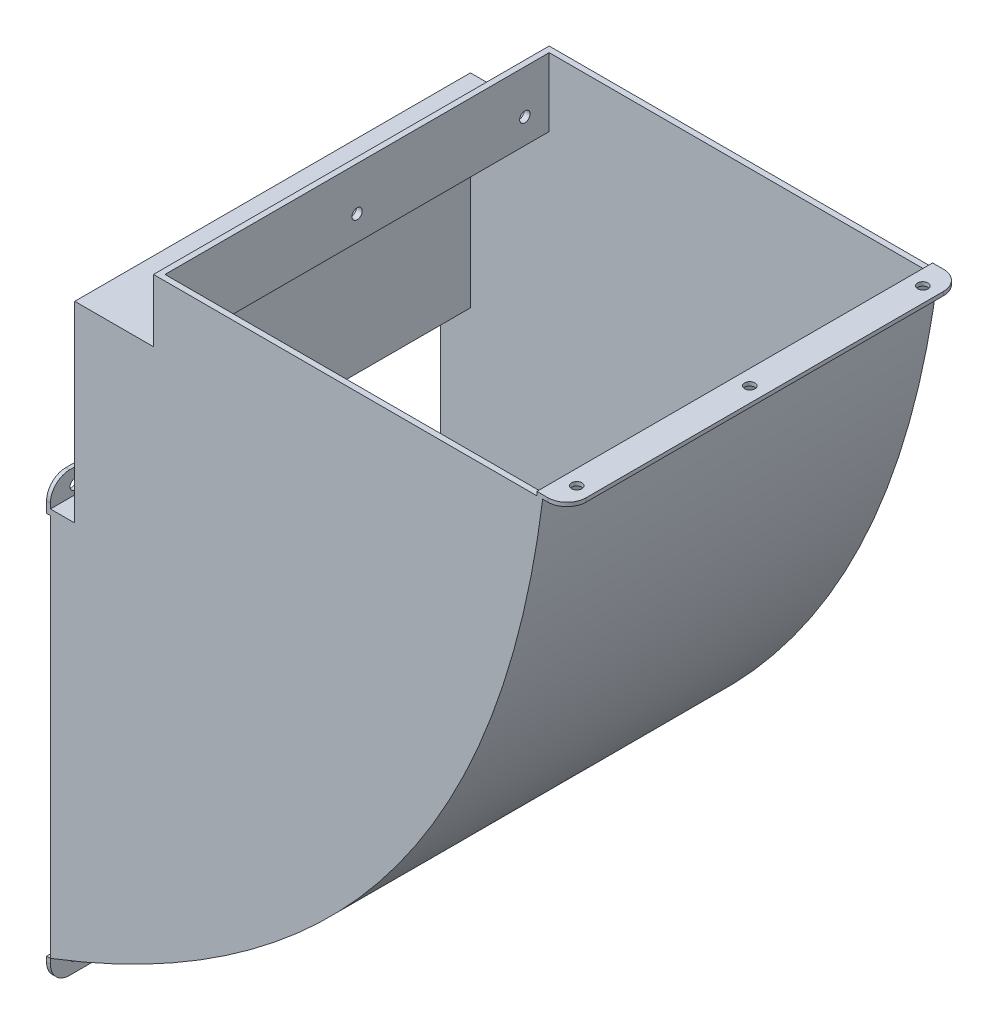
from build123d import *

# Parameters (mm, degrees)
BOSS_EXTRUDE3_DEPTH = 206.587093
SHELL1_T            = -3
BOSS_EXTRUDE4_DEPTH = 2
BOSS_EXTRUDE5_DEPTH = 2
SKETCH8_R           = 2.7
CUT_EXTRUDE2_DEPTH  = 3
SKETCH9_R           = 2.7
CUT_EXTRUDE3_DEPTH  = 2
SKETCH11_R          = 2.7
CUT_EXTRUDE4_DEPTH  = 2


with BuildPart() as part:
    # Sketch1 → Boss-Extrude3 (new body)
    with BuildSketch(Plane.XY):
        with BuildLine():
            Line((244.319092767, 234.634840909), (41.119092767, 234.634840909))
            Line((41.119092767, 234.634840909), (41.119092767, 201.934840909))
            Line((41.119092767, 201.934840909), (0, 201.934840909))
            Line((0, 201.934840909), (0, 101.672858907))
            Line((0, 101.672858907), (-12.7, 101.672858907))
            Line((-12.7, 101.672858907), (-12.7, -101.527141093))
            add(Edge.make_bspline(
                [(-12.7, -101.527141093), (212.797902698, -15.185130796), (244.319092767, 234.634840909)],
                knots=[0, 0, 0, 1, 1, 1], degree=2))
        make_face()
    extrude(amount=BOSS_EXTRUDE3_DEPTH)

    # Shell1
    shell1_openings = [part.faces().sort_by_distance(p)[0] for p in [
        (142.719092767, 234.634840909, 103.2935465),
        (-12.7, 0.072858907, 103.2935465),
    ]]
    offset(amount=SHELL1_T, openings=shell1_openings, kind=Kind.INTERSECTION)

    # Sketch4 → Boss-Extrude4 (add)
    with BuildSketch(Plane(origin=(0, 234.634840909, 0), x_dir=(1, 0, 0), z_dir=(0, 1, 0))):
        with BuildLine():
            Line((257.019092767, -10), (257.019092767, -196.587092864))
            ThreePointArc((257.019092767, -196.587092864), (254.090160579, -203.658160676), (247.019092767, -206.587092864))
            Line((247.019092767, -206.587092864), (244.319092767, -206.587092864))
            Line((244.319092767, -206.587092864), (241.295184716, -206.587092864))
            Line((241.295184716, -206.587092864), (241.295184716, 0))
            Line((241.295184716, 0), (247.019092767, 0))
            ThreePointArc((247.019092767, 0), (254.090160579, -2.928932188), (257.019092767, -10))
        make_face()
    extrude(amount=BOSS_EXTRUDE4_DEPTH)

    # Sketch5 → Boss-Extrude5 (add)
    with BuildSketch(Plane.ZY.offset(12.7)):
        with BuildLine():
            Line((10, 114.372858907), (196.587092864, 114.372858907))
            ThreePointArc((196.587092864, 114.372858907), (203.658160676, 111.443926719), (206.587092864, 104.372858907))
            Line((206.587092864, 104.372858907), (206.587092864, 98.672858907))
            Line((206.587092864, 98.672858907), (0, 98.672858907))
            Line((0, 98.672858907), (0, 104.372858907))
            ThreePointArc((0, 104.372858907), (2.928932188, 111.443926719), (10, 114.372858907))
        make_face()
        with BuildLine():
            Line((0, -101.527141093), (0, -104.227141093))
            ThreePointArc((0, -104.227141093), (2.928932188, -111.298208905), (10, -114.227141093))
            Line((10, -114.227141093), (196.587092864, -114.227141093))
            ThreePointArc((196.587092864, -114.227141093), (203.658160676, -111.298208905), (206.587092864, -104.227141093))
            Line((206.587092864, -104.227141093), (206.587092864, -101.527141093))
            Line((206.587092864, -101.527141093), (0, -101.527141093))
        make_face()
    extrude(amount=BOSS_EXTRUDE5_DEPTH)


with BuildPart() as boss_extrude5_piece_1:
    # of the separate pieces the step leaves, piece 1, a body of its own (boss_extrude5_pieces)
    add(part.part.solids().sort_by_distance((41.119092767, 234.634840909, 0))[0])

    # Sketch8 → Cut-Extrude2 (cut)
    with BuildSketch(Plane(origin=(44.119092767, 0, 0), x_dir=(0, 0, -1), z_dir=(1, 0, 0))):
        with Locations(Location((-190.887092864, 211.934840909, 0), (0, 0, 90))):
            Circle(SKETCH8_R)
        with Locations(Location((-103.293546432, 211.934840909, 0), (0, 0, 90))):
            Circle(SKETCH8_R)
        with Locations(Location((-15.7, 211.934840909, 0), (0, 0, 90))):
            Circle(SKETCH8_R)
    extrude(amount=-CUT_EXTRUDE2_DEPTH, mode=Mode.SUBTRACT)

    # Sketch9 → Cut-Extrude3 (cut)
    with BuildSketch(Plane(origin=(0, 236.634840909, 0), x_dir=(1, 0, 0), z_dir=(0, 1, 0))):
        with Locations(Location((249.157138742, -12.931235523, 0), (0, 0, 180))):
            Circle(SKETCH9_R)
        with Locations(Location((249.157138742, -103.293546432, 0), (0, 0, 180))):
            Circle(SKETCH9_R)
        with Locations(Location((249.157138742, -193.655857341, 0), (0, 0, 180))):
            Circle(SKETCH9_R)
    extrude(amount=-CUT_EXTRUDE3_DEPTH, mode=Mode.SUBTRACT)


with BuildPart() as boss_extrude5_piece_2:
    # of the separate pieces the step leaves, piece 2, a body of its own (boss_extrude5_pieces)
    add(part.part.solids().sort_by_distance((-14.7, -101.527141093, 206.587092864))[0])


with BuildPart() as cut_extrude4_tool:
    # Sketch11 → Cut-Extrude4 (new body)
    with BuildSketch(Plane.ZY.offset(14.7)):
        with Locations(Location((12.933859514, 106.522858907, 0), (0, 0, 270))):
            Circle(SKETCH11_R)
        with Locations(Location((103.293546432, 106.522858907, 0), (0, 0, 270))):
            Circle(SKETCH11_R)
        with Locations(Location((193.653233351, 106.522858907, 0), (0, 0, 270))):
            Circle(SKETCH11_R)
        with Locations(Location((193.728321895, -106.386237609, 0), (0, 0, 270))):
            Circle(SKETCH11_R)
        with Locations(Location((103.368657455, -106.44997351, 0), (0, 0, 270))):
            Circle(SKETCH11_R)
        with Locations(Location((13.008993014, -106.51370941, 0), (0, 0, 270))):
            Circle(SKETCH11_R)
    extrude(amount=-CUT_EXTRUDE4_DEPTH)


with BuildPart() as boss_extrude5_piece_1_1:
    add(boss_extrude5_piece_1.part)

    # Cut-Extrude4: cut by cut_extrude4_tool
    add(cut_extrude4_tool.part, mode=Mode.SUBTRACT)


with BuildPart() as boss_extrude5_piece_2_1:
    add(boss_extrude5_piece_2.part)

    # Cut-Extrude4: cut by cut_extrude4_tool
    add(cut_extrude4_tool.part, mode=Mode.SUBTRACT)


solid = Compound([boss_extrude5_piece_1_1.part, boss_extrude5_piece_2_1.part])
